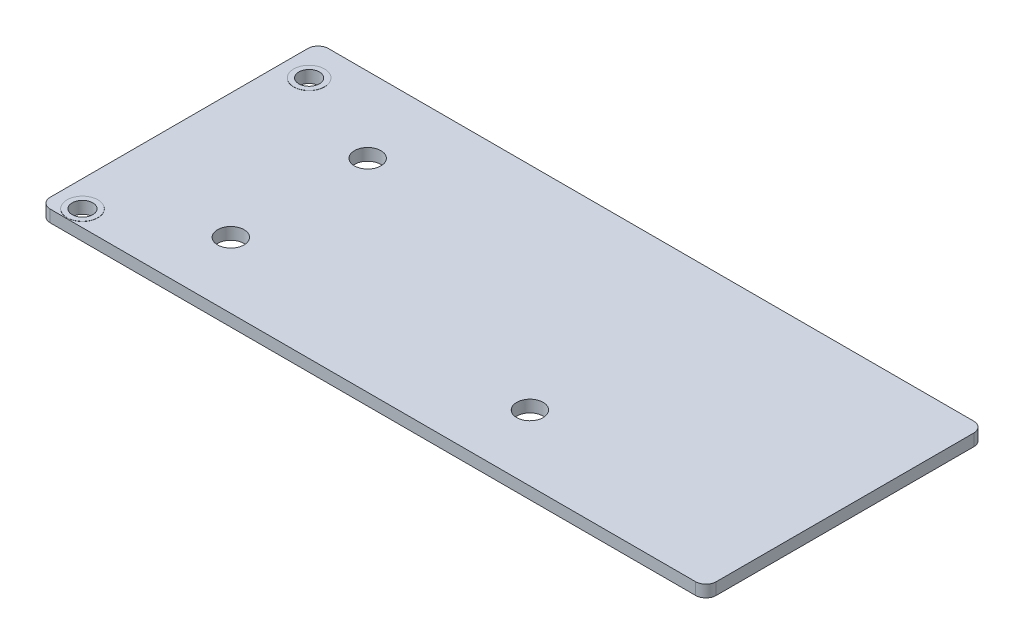
from build123d import *

# Parameters (mm, degrees)
SKETCH1_W                = 64.65
SKETCH1_H                = 27
BOSS_EXTRUDE1_DEPTH      = 1.16
FILLET1_R                = 1
SKETCH2_R                = 1
SKETCH2_R_2              = 1.285
CUT_EXTRUDE1_DEPTH       = 36.049981812
BOSS_EXTRUDE2_DEPTH      = 0.015
BOSS_EXTRUDE2_DEPTH_BACK = 1.165
SKETCH3_R                = 1.5
SKETCH3_R_2              = 1


with BuildPart() as part:
    # Sketch1 → Boss-Extrude1 (new body)
    with BuildSketch(Plane(origin=(0, 0, 0), x_dir=(1, 0, 0), z_dir=(0, 1, 0))):
        Rectangle(SKETCH1_W, SKETCH1_H)
    extrude(amount=BOSS_EXTRUDE1_DEPTH)

    # Fillet1
    fillet1_edges = [part.edges().sort_by_distance(p)[0] for p in [
        (32.325, 0.58, 13.5),
        (-32.325, 0.58, 13.5),
        (-32.325, 0.58, -13.5),
        (32.325, 0.58, -13.5),
    ]]
    fillet(fillet1_edges, radius=FILLET1_R)

    # Sketch2 → Cut-Extrude1 (cut, through all)
    with BuildSketch(Plane(origin=(0, 1.16, 0), x_dir=(1, 0, 0), z_dir=(0, 1, 0))):
        with Locations(Location((-29.775, -11.92, 0), (0, 0, 270))):
            Circle(SKETCH2_R)
        with Locations(Location((-29.775, 10.08, 0), (0, 0, 270))):
            Circle(SKETCH2_R)
        with Locations(Location((-20.19, -7.105, 0), (0, 0, 270))):
            Circle(SKETCH2_R_2)
        with Locations(Location((-20.19, 6.18, 0), (0, 0, 270))):
            Circle(SKETCH2_R_2)
        with Locations(Location((8.845, -7.105, 0), (0, 0, 270))):
            Circle(SKETCH2_R_2)
    extrude(amount=-CUT_EXTRUDE1_DEPTH, mode=Mode.SUBTRACT)

    # Sketch3 → Boss-Extrude2 (add, two sides: drawn at the far end of the back side and taken through both)
    # profile 1 of 2: a face of its own
    with BuildSketch(Plane(origin=(0, 1.16, 0), x_dir=(1, 0, 0), z_dir=(0, 1, 0)).offset(-BOSS_EXTRUDE2_DEPTH_BACK)):
        with Locations(Location((-29.775, -11.92, 0), (0, 0, 270))):
            Circle(SKETCH3_R)
        with Locations(Location((-29.775, -11.92, 0), (0, 0, 270))):
            Circle(SKETCH3_R_2, mode=Mode.SUBTRACT)
    # profile 2 of 2: a face of its own
    with BuildSketch(Plane(origin=(0, 1.16, 0), x_dir=(1, 0, 0), z_dir=(0, 1, 0)).offset(-BOSS_EXTRUDE2_DEPTH_BACK)):
        with Locations(Location((-29.775, 10.08, 0), (0, 0, 270))):
            Circle(SKETCH3_R)
        with Locations(Location((-29.775, 10.08, 0), (0, 0, 270))):
            Circle(SKETCH3_R_2, mode=Mode.SUBTRACT)
    extrude(amount=BOSS_EXTRUDE2_DEPTH + BOSS_EXTRUDE2_DEPTH_BACK)


solid = part.part
